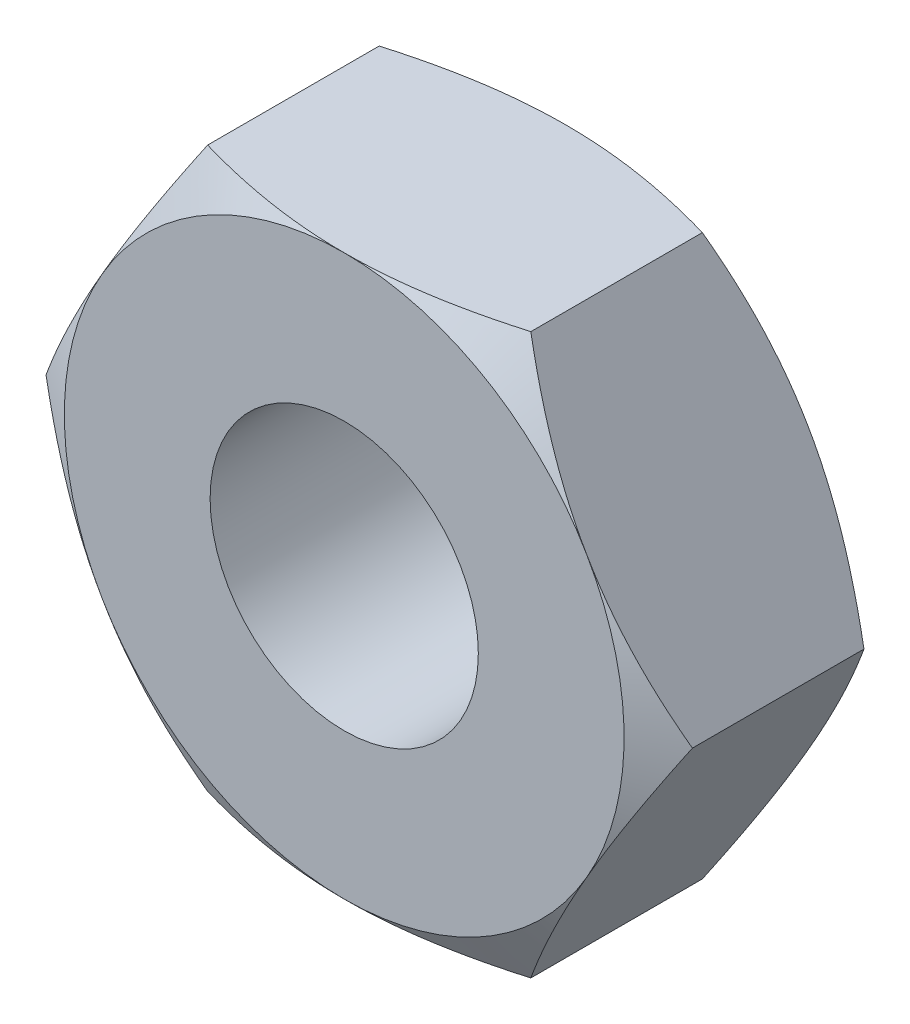
from build123d import *

# Parameters (mm, degrees)
SKETCH1_R           = 1.15
BOSS_EXTRUDE1_DEPTH = 1.9
SKETCH2_OUTSIDE_W   = 43.698
SKETCH2_OUTSIDE_H   = 42.956
SKETCH2_OUTSIDE_R   = 2.4
CUT_EXTRUDE1_DEPTH  = 10
CUT_EXTRUDE1_DRAFT  = -60
SKETCH3_OUTSIDE_W   = 43.698
SKETCH3_OUTSIDE_H   = 42.956
SKETCH3_OUTSIDE_R   = 2.4
CUT_EXTRUDE2_DEPTH  = 10
CUT_EXTRUDE2_DRAFT  = -60


with BuildPart() as part:
    # Sketch1 → Boss-Extrude1 (new body)
    with BuildSketch(Plane.XY):
        Polygon((-1.385640646, 2.4), (-2.771281292, 0), (-1.385640646, -2.4), (1.385640646, -2.4), (2.771281292, 0), (1.385640646, 2.4), align=None)
        with Locations(Location((0, 0, 0), (0, 0, 180))):
            Circle(SKETCH1_R, mode=Mode.SUBTRACT)
    extrude(amount=BOSS_EXTRUDE1_DEPTH)


with BuildPart() as cut_extrude1_tool:
    # Sketch2 outside → Cut-Extrude1 (with draft: the straight prism first)
    with BuildSketch(Plane.XY.offset(1.9)):
        Rectangle(SKETCH2_OUTSIDE_W, SKETCH2_OUTSIDE_H)
        Circle(SKETCH2_OUTSIDE_R, mode=Mode.SUBTRACT)
    extrude(amount=-CUT_EXTRUDE1_DEPTH)
    # Cut-Extrude1: the draft: its side faces are tilted about the plane it starts from
    cut_extrude1_sides = [cut_extrude1_tool.faces().sort_by_distance(p)[0] for p in [
        (0, -21.478, -3.1),
        (21.849, 0, -3.1),
        (0, 21.478, -3.1),
        (-21.849, 0, -3.1),
        (-2.4, 0, -3.1),
    ]]
    draft(cut_extrude1_sides, Plane.XY.offset(1.9), CUT_EXTRUDE1_DRAFT)


with BuildPart() as part_1:
    add(part.part)

    # Cut-Extrude1: cut by cut_extrude1_tool
    add(cut_extrude1_tool.part, mode=Mode.SUBTRACT)


with BuildPart() as cut_extrude2_tool:
    # Sketch3 outside → Cut-Extrude2 (with draft: the straight prism first)
    with BuildSketch(Plane(origin=(0, 0, 0), x_dir=(-1, 0, 0), z_dir=(0, 0, -1))):
        Rectangle(SKETCH3_OUTSIDE_W, SKETCH3_OUTSIDE_H)
        Circle(SKETCH3_OUTSIDE_R, mode=Mode.SUBTRACT)
    extrude(amount=-CUT_EXTRUDE2_DEPTH)
    # Cut-Extrude2: the draft: its side faces are tilted about the plane it starts from
    cut_extrude2_sides = [cut_extrude2_tool.faces().sort_by_distance(p)[0] for p in [
        (0, -21.478, 5),
        (-21.849, 0, 5),
        (0, 21.478, 5),
        (21.849, 0, 5),
        (2.4, 0, 5),
    ]]
    draft(cut_extrude2_sides, Plane(origin=(0, 0, 0), x_dir=(-1, 0, 0), z_dir=(0, 0, -1)), CUT_EXTRUDE2_DRAFT)


with BuildPart() as part_2:
    add(part_1.part)

    # Cut-Extrude2: cut by cut_extrude2_tool
    add(cut_extrude2_tool.part, mode=Mode.SUBTRACT)


solid = part_2.part
